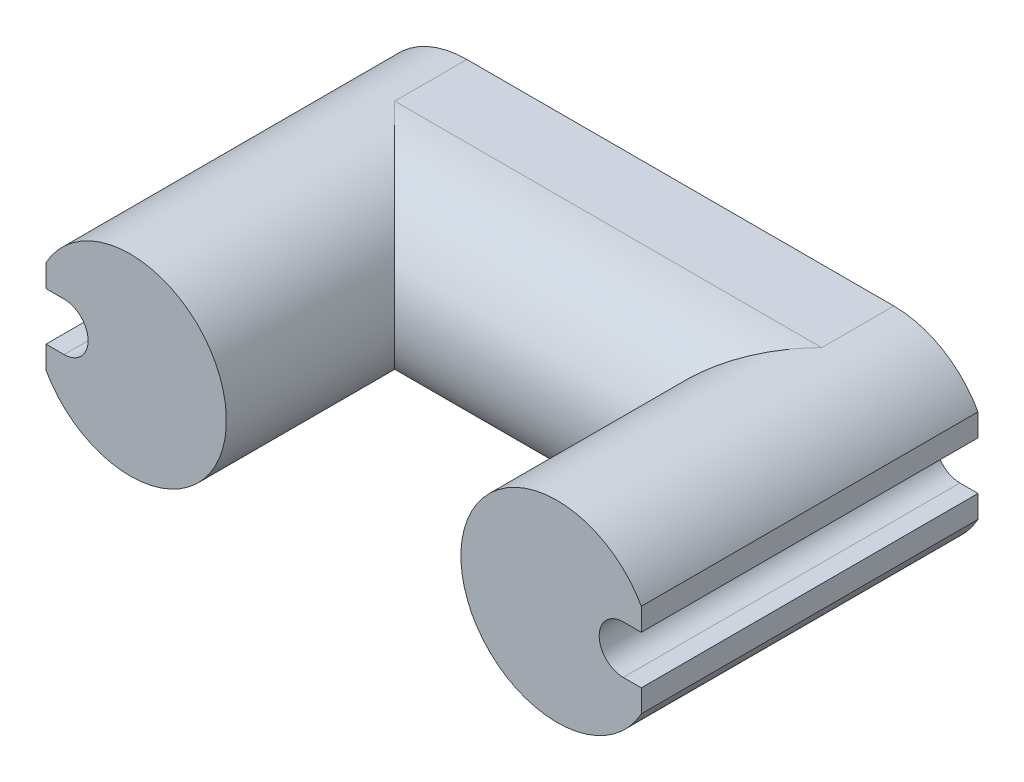
from build123d import *

# Parameters (mm, degrees)
EXTRUDE_1_DEPTH   = 28
EXTRUDE_1_2_DEPTH = 28
EXTRUDE_START     = -17.75
EXTRUDE_2_DEPTH   = 35.5


with BuildPart() as part:
    # Эскиз1 → Вытянуть1 (new body)
    with BuildSketch(Plane.XY):
        with BuildLine():
            Line((-23.25, 2), (-24.75, 2))
            Line((-24.75, 2), (-24.75, 3.872983346))
            ThreePointArc((-24.75, 3.872983346), (-9.75, 0), (-24.75, -3.872983346))
            Line((-24.75, -3.872983346), (-24.75, -2))
            Line((-24.75, -2), (-23.25, -2))
            ThreePointArc((-23.25, -2), (-21.25, 0), (-23.25, 2))
        make_face()
    extrude(amount=-EXTRUDE_1_DEPTH)



with BuildPart() as body_2:
    # Эскиз1 → Extrude 1 2 (new body)
    with BuildSketch(Plane.XY):
        with BuildLine():
            Line((23.25, -2), (24.75, -2))
            Line((24.75, -2), (24.75, -3.872983346))
            ThreePointArc((24.75, -3.872983346), (9.75, 0), (24.75, 3.872983346))
            Line((24.75, 3.872983346), (24.75, 2))
            Line((24.75, 2), (23.25, 2))
            ThreePointArc((23.25, 2), (21.25, 0), (23.25, -2))
        make_face()
    extrude(amount=-EXTRUDE_1_2_DEPTH)


with BuildPart() as part_1:
    add(part.part)

    add(body_2.part)  # Вытянуть2 merges body 2
    # Эскиз2 → Вытянуть2 (add)
    with BuildSketch(Plane(origin=(0, 0, 0), x_dir=(0, 0, -1), z_dir=(1, 0, 0)).offset(EXTRUDE_START)):
        with BuildLine():
            Line((28, -8), (28, 8))
            Line((28, 8), (22, 8))
            ThreePointArc((22, 8), (14, 0), (22, -8))
            Line((22, -8), (28, -8))
        make_face()
    extrude(amount=EXTRUDE_2_DEPTH)


solid = part_1.part
